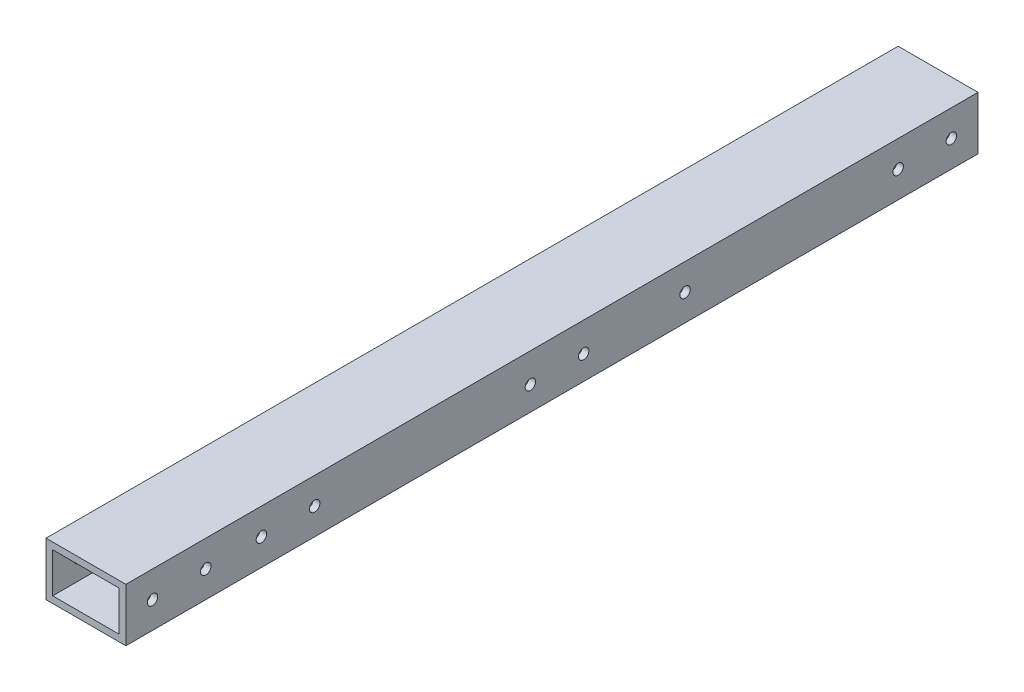
from build123d import *

# Parameters (mm, degrees)
BOSS_EXTRUDE1_DEPTH      = 317.499999
BOSS_EXTRUDE1_DEPTH_BACK = 317.499999
SKETCH3_W                = 38.1
SKETCH3_H                = 25.4
SKETCH3_W_2              = 31.75
SKETCH3_H_2              = 19.05
MOUNTING_HOLES_D         = 4.9784
RIO_HOLES_D              = 4.9784
F_10_CLEARANCE_HOLE1_D   = 4.9784


with BuildPart() as part:
    # Sketch3 → Boss-Extrude1 (new, two sides: drawn at the far end of the back side and taken through both)
    with BuildSketch(Plane.XY.offset(-BOSS_EXTRUDE1_DEPTH_BACK)):
        Rectangle(SKETCH3_W, SKETCH3_H)
        Rectangle(SKETCH3_W_2, SKETCH3_H_2, mode=Mode.SUBTRACT)
    extrude(amount=BOSS_EXTRUDE1_DEPTH + BOSS_EXTRUDE1_DEPTH_BACK)

    # Mounting Holes (through all)
    with Locations(Plane.ZY.offset(19.05)):
        with Locations((279.400000508, 0), (304.800000508, 0), (-76.2, 0)):
            Hole(MOUNTING_HOLES_D / 2)

    # Rio Holes (through all)
    with Locations(Plane.ZY.offset(19.05)):
        with Locations((-50.8, 0), (50.8, 0)):
            Hole(RIO_HOLES_D / 2)

    # SurfaceCut1
    split(bisect_by=Plane(origin=(0, 0, -88.899999492), x_dir=(-1, 0, 0), z_dir=(0, 0, -1)), keep=Keep.BOTTOM)

    # #10 Clearance Hole1 (through all)
    with Locations(Plane(origin=(19.05, 0, 0), x_dir=(0, 0, -1), z_dir=(1, 0, 0))):
        with Locations((-252.857000508, -5.03e-07), (-227.457000508, -5.03e-07), (-99.187000508, -1.231595708), (-124.587000508, -1.231595708)):
            Hole(F_10_CLEARANCE_HOLE1_D / 2)


solid = part.part
